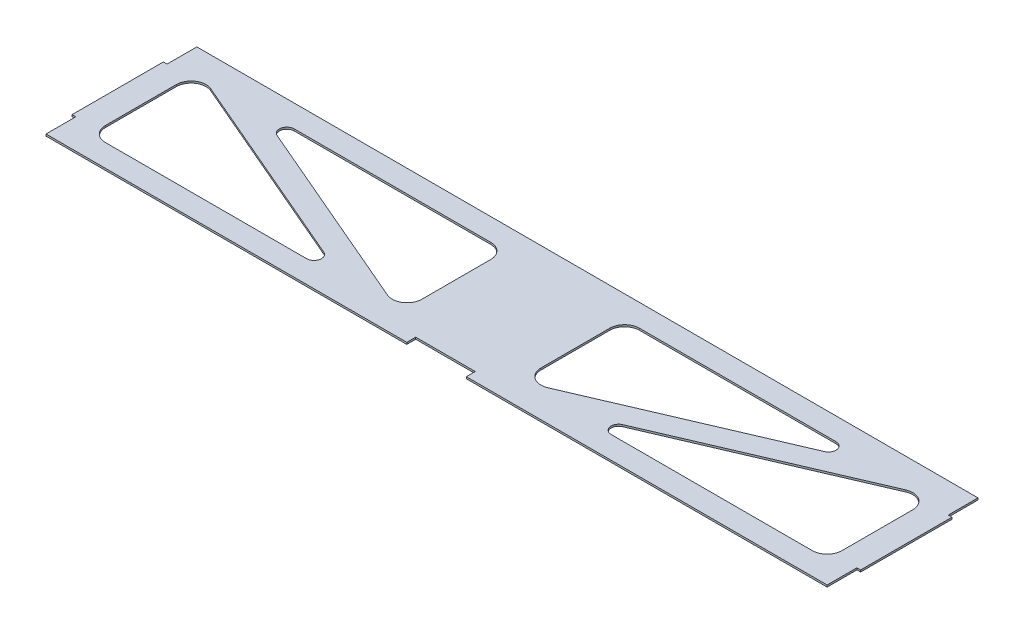
from build123d import *

# Parameters (mm, degrees)
BOSS_EXTRUDE1_DEPTH = 1.5875
CUT_EXTRUDE2_DEPTH  = 343.657797193
WING_SPAR_CUT_W     = 50.8
WING_SPAR_CUT_H     = 7.62
CUT_EXTRUDE3_DEPTH  = 343.657797193


with BuildPart() as part:
    # Sketch1 → Boss-Extrude1 (new body)
    with BuildSketch(Plane(origin=(0, 0, 0), x_dir=(1, 0, 0), z_dir=(0, 1, 0))):
        Polygon((-333.375, 38.989), (-333.375, 64.389), (333.375, 64.389), (333.375, 38.989), (336.55, 38.989), (336.55, -38.989), (333.375, -38.989), (333.375, -64.389), (-333.375, -64.389), (-333.375, -38.989), (-336.55, -38.989), (-336.55, 38.989), align=None)
    extrude(amount=BOSS_EXTRUDE1_DEPTH)

    # Sketch3 → Cut-Extrude2 (cut, through all)
    with BuildSketch(Plane(origin=(0, 1.5875, 0), x_dir=(1, 0, 0), z_dir=(0, 1, 0))):
        with BuildLine():
            Line((-314.325, 27.760799149), (-314.325, -32.639))
            ThreePointArc((-314.325, -32.639), (-310.605256121, -41.619256121), (-301.625, -45.339))
            Line((-301.625, -45.339), (-129.997745545, -45.339))
            ThreePointArc((-129.997745545, -45.339), (-123.777758329, -40.267381409), (-127.49333105, -33.153727253))
            Line((-127.49333105, -33.153727253), (-296.616171009, 39.431344643))
            ThreePointArc((-296.616171009, 39.431344643), (-308.613485953, 38.365093755), (-314.325, 27.760799149))
        make_face()
        with BuildLine():
            Line((-231.183231716, 45.339), (-63.5, 45.339))
            ThreePointArc((-63.5, 45.339), (-54.519743879, 41.619256121), (-50.8, 32.639))
            Line((-50.8, 32.639), (-50.8, -26.068081748))
            ThreePointArc((-50.8, -26.068081748), (-56.511514047, -36.672376354), (-68.508828991, -37.738627243))
            Line((-68.508828991, -37.738627243), (-233.687646211, 33.153727253))
            ThreePointArc((-233.687646211, 33.153727253), (-237.403218932, 40.267381409), (-231.183231716, 45.339))
        make_face()
        with BuildLine():
            Line((68.508828991, -37.738627243), (233.687646211, 33.153727253))
            ThreePointArc((233.687646211, 33.153727253), (237.403218932, 40.267381409), (231.183231716, 45.339))
            Line((231.183231716, 45.339), (63.5, 45.339))
            ThreePointArc((63.5, 45.339), (54.519743879, 41.619256121), (50.8, 32.639))
            Line((50.8, 32.639), (50.8, -26.068081748))
            ThreePointArc((50.8, -26.068081748), (56.511514047, -36.672376354), (68.508828991, -37.738627243))
        make_face()
        with BuildLine():
            Line((314.325, 27.760799149), (314.325, -32.639))
            ThreePointArc((314.325, -32.639), (310.605256121, -41.619256121), (301.625, -45.339))
            Line((301.625, -45.339), (129.997745545, -45.339))
            ThreePointArc((129.997745545, -45.339), (123.777758329, -40.267381409), (127.49333105, -33.153727253))
            Line((127.49333105, -33.153727253), (296.616171009, 39.431344643))
            ThreePointArc((296.616171009, 39.431344643), (308.613485953, 38.365093755), (314.325, 27.760799149))
        make_face()
    extrude(amount=-CUT_EXTRUDE2_DEPTH, mode=Mode.SUBTRACT)

    # Wing Spar Cut → Cut-Extrude3 (cut, through all)
    with BuildSketch(Plane(origin=(0, 1.5875, 0), x_dir=(1, 0, 0), z_dir=(0, 1, 0))):
        with Locations((0, -60.579)):
            Rectangle(WING_SPAR_CUT_W, WING_SPAR_CUT_H)
    extrude(amount=-CUT_EXTRUDE3_DEPTH, mode=Mode.SUBTRACT)


solid = part.part
